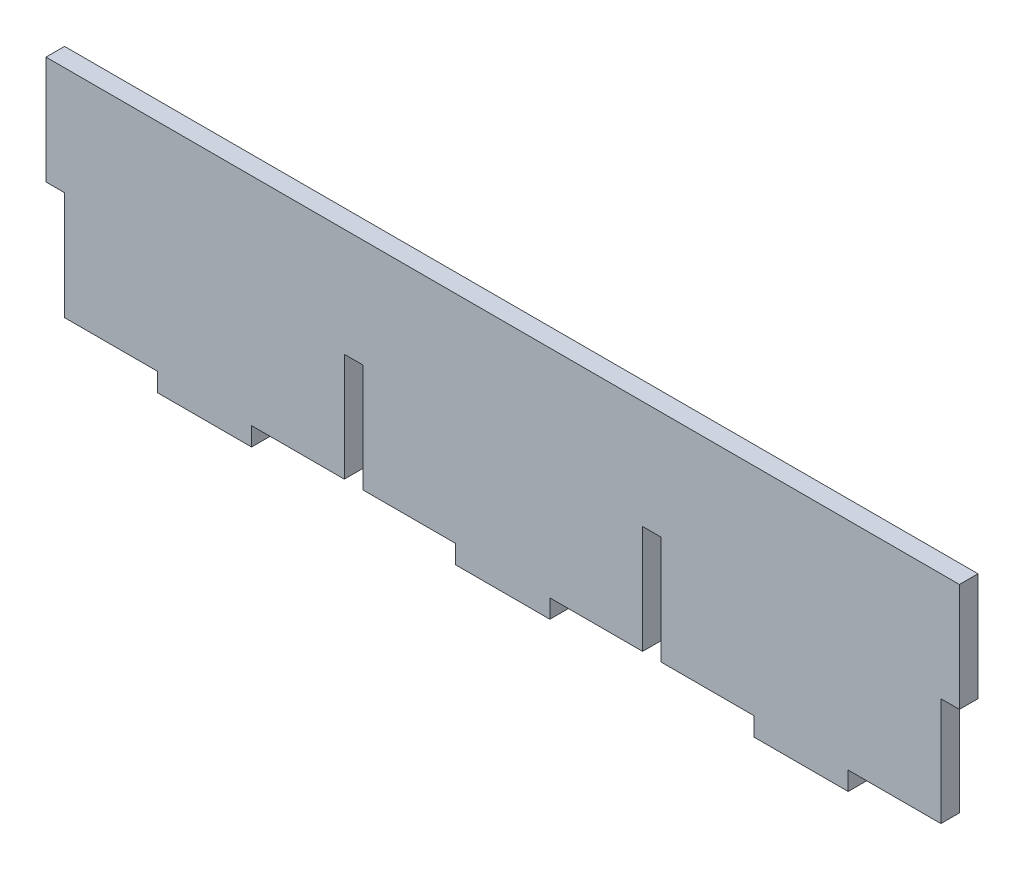
from build123d import *

# Parameters (mm, degrees)
BOSS_EXTRUDE1_DEPTH = 3


with BuildPart() as part:
    # Sketch1 → Boss-Extrude1 (new body)
    with BuildSketch(Plane.XY):
        Polygon((70.875, 1.5), (73.875, 1.5), (73.875, 19), (-73.875, 19), (-73.875, 1.5), (-70.875, 1.5), (-70.875, -16), (-55.875, -16), (-55.875, -19), (-40.625, -19), (-40.625, -16), (-25.625, -16), (-25.625, 1.5), (-22.625, 1.5), (-22.625, -16), (-7.625, -16), (-7.625, -19), (7.625, -19), (7.625, -16), (22.625, -16), (22.625, 1.5), (25.625, 1.5), (25.625, -16), (40.625, -16), (40.625, -19), (55.875, -19), (55.875, -16), (70.875, -16), align=None)
    extrude(amount=BOSS_EXTRUDE1_DEPTH)


solid = part.part
